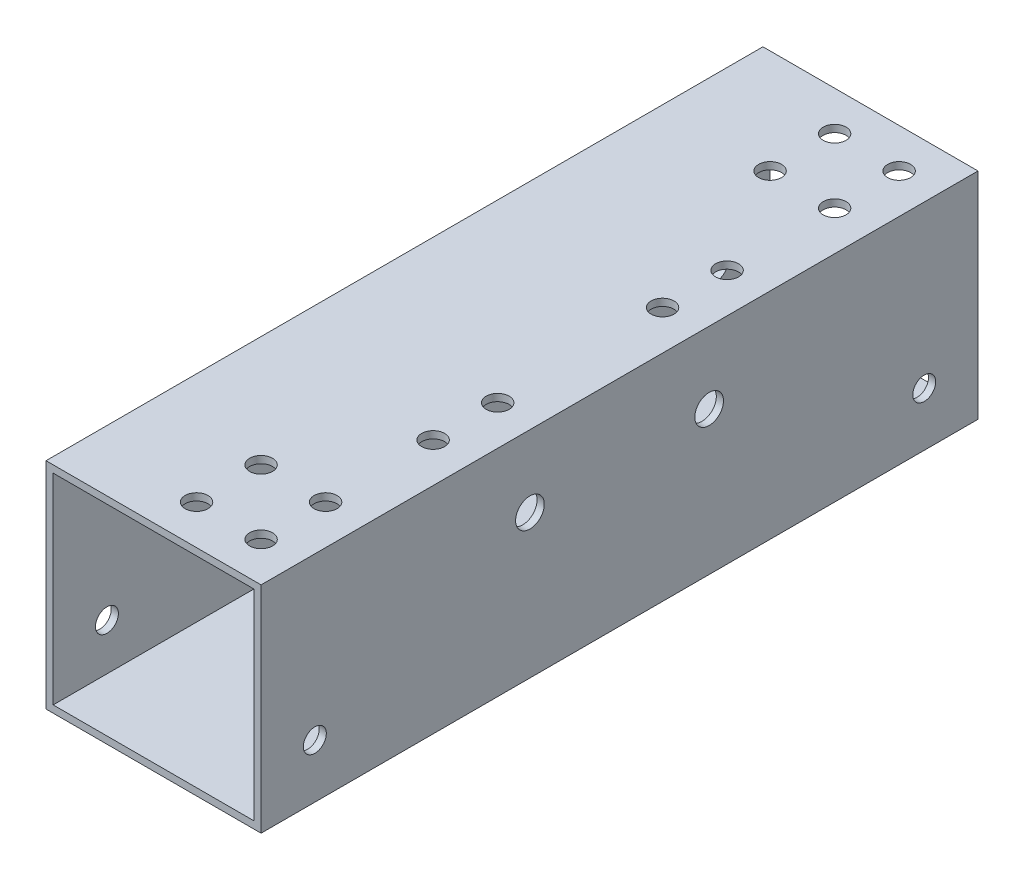
from build123d import *

# Parameters (mm, degrees)
SKETCH_1_W          = 30
SKETCH_1_H          = 30
SKETCH_1_W_2        = 28
SKETCH_1_H_2        = 28
EXTRUDE_1_DEPTH     = 100
SKETCH_3_R          = 1.6
CUT_EXTRUDE_1_DEPTH = 106.475115549
SKETCH_5_R          = 1.6
CUT_EXTRUDE_3_DEPTH = 106.475115549
SKETCH_6_R          = 2
CUT_EXTRUDE_4_DEPTH = 106.475115549
SKETCH_7_W          = 17.574392575
SKETCH_7_H          = 17.83033033
SKETCH_7_W_2        = 16.806579307
SKETCH_7_H_2        = 18.854081354
EXTRUDE_2_DEPTH     = 1
CUT_EXTRUDE_5_REACH = 107.475


with BuildPart() as part:
    # 草图1 → 凸台-拉伸1 (new body)
    with BuildSketch(Plane.XY):
        Rectangle(SKETCH_1_W, SKETCH_1_H)
        Rectangle(SKETCH_1_W_2, SKETCH_1_H_2, mode=Mode.SUBTRACT)
    extrude(amount=EXTRUDE_1_DEPTH)

    # 草图3 → 切除-拉伸1 (cut, through all)
    with BuildSketch(Plane(origin=(0, 15, 0), x_dir=(1, 0, 0), z_dir=(0, 1, 0))):
        with Locations(Location((0.5, -94.5, 0), (0, 0, 270))):
            Circle(SKETCH_3_R)
        with Locations(Location((9.5, -94.5, 0), (0, 0, 270))):
            Circle(SKETCH_3_R)
        with Locations(Location((9.5, -85.5, 0), (0, 0, 270))):
            Circle(SKETCH_3_R)
        with Locations(Location((0.5, -85.5, 0), (0, 0, 270))):
            Circle(SKETCH_3_R)
        with Locations(Location((9.5, -14.5, 0), (0, 0, 270))):
            Circle(SKETCH_3_R)
        with Locations(Location((9.5, -5.5, 0), (0, 0, 270))):
            Circle(SKETCH_3_R)
        with Locations(Location((0.5, -5.5, 0), (0, 0, 270))):
            Circle(SKETCH_3_R)
        with Locations(Location((0.5, -14.5, 0), (0, 0, 270))):
            Circle(SKETCH_3_R)
        with Locations(Location((9.5, -70.5, 0), (0, 0, 270))):
            Circle(SKETCH_3_R)
        with Locations(Location((9.5, -61.5, 0), (0, 0, 270))):
            Circle(SKETCH_3_R)
        with Locations(Location((9.5, -38.5, 0), (0, 0, 270))):
            Circle(SKETCH_3_R)
        with Locations(Location((9.5, -29.5, 0), (0, 0, 270))):
            Circle(SKETCH_3_R)
    extrude(amount=-CUT_EXTRUDE_1_DEPTH, mode=Mode.SUBTRACT)

    # 草图5 → 切除-拉伸3 (cut, through all)
    with BuildSketch(Plane(origin=(15, 0, 0), x_dir=(0, 0, -1), z_dir=(1, 0, 0))):
        with Locations(Location((-92.5, -7.5, 0), (0, 0, 90))):
            Circle(SKETCH_5_R)
        with Locations(Location((-7.5, -7.5, 0), (0, 0, 90))):
            Circle(SKETCH_5_R)
    extrude(amount=-CUT_EXTRUDE_3_DEPTH, mode=Mode.SUBTRACT)

    # 草图6 → 切除-拉伸4 (cut, through all)
    with BuildSketch(Plane(origin=(15, 0, 0), x_dir=(0, 0, -1), z_dir=(1, 0, 0))):
        with Locations(Location((-62.5, 5, 0), (0, 0, 90))):
            Circle(SKETCH_6_R)
        with Locations(Location((-37.5, 5, 0), (0, 0, 90))):
            Circle(SKETCH_6_R)
    extrude(amount=-CUT_EXTRUDE_4_DEPTH, mode=Mode.SUBTRACT)

    # 草图7 → 凸台-拉伸2 (add)
    with BuildSketch(Plane.XZ.offset(15)):
        with Locations((4.265629266, 89.627695878)):
            Rectangle(SKETCH_7_W, SKETCH_7_H)
        with Locations((4.6495359, 10.628241878)):
            Rectangle(SKETCH_7_W_2, SKETCH_7_H_2)
    extrude(amount=-EXTRUDE_2_DEPTH)

    # 草图8 → 切除-拉伸5 (cut, up to next)
    with BuildSketch(Plane.XZ.offset(15), mode=Mode.PRIVATE) as cut_extrude_5_sk1:
        with BuildLine():
            Line((14, 70.5), (14, 61.5))
            ThreePointArc((14, 61.5), (9.5, 57), (5, 61.5))
            Line((5, 61.5), (5, 70.5))
            ThreePointArc((5, 70.5), (9.5, 75), (14, 70.5))
        make_face()
    cut_extrude_5_tool1 = extrude(cut_extrude_5_sk1.sketch, amount=-CUT_EXTRUDE_5_REACH, mode=Mode.PRIVATE) & part.part
    # 草图8 → 切除-拉伸5 (cut, up to next)
    with BuildSketch(Plane.XZ.offset(15), mode=Mode.PRIVATE) as cut_extrude_5_sk2:
        with BuildLine():
            Line((14, 29.5), (14, 38.5))
            ThreePointArc((14, 38.5), (9.5, 43), (5, 38.5))
            Line((5, 38.5), (5, 29.5))
            ThreePointArc((5, 29.5), (9.5, 25), (14, 29.5))
        make_face()
    cut_extrude_5_tool2 = extrude(cut_extrude_5_sk2.sketch, amount=-CUT_EXTRUDE_5_REACH, mode=Mode.PRIVATE) & part.part
    add(cut_extrude_5_tool1.solids().sort_by_distance((9.5, -15, 66))[0], mode=Mode.SUBTRACT)
    add(cut_extrude_5_tool2.solids().sort_by_distance((9.5, -15, 34))[0], mode=Mode.SUBTRACT)


solid = part.part
